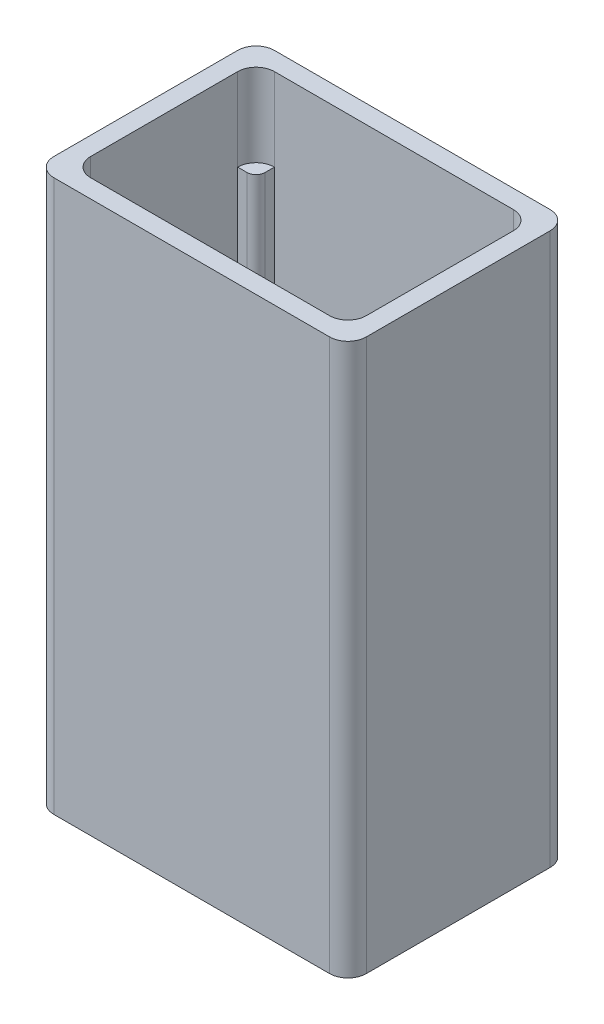
from build123d import *

# Parameters (mm, degrees)
BOSS_EXTRUDE4_DEPTH = 60
BOSS_EXTRUDE5_DEPTH = 51


with BuildPart() as part:
    # Sketch8 → Boss-Extrude4 (new body)
    with BuildSketch(Plane(origin=(0, 58, 0), x_dir=(1, 0, 0), z_dir=(0, 1, 0))):
        with BuildLine():
            Line((-15, -12), (15, -12))
            ThreePointArc((15, -12), (16.414213562, -11.414213562), (17, -10))
            Line((17, -10), (17, 10))
            ThreePointArc((17, 10), (16.414213562, 11.414213562), (15, 12))
            Line((15, 12), (-15, 12))
            ThreePointArc((-15, 12), (-16.414213562, 11.414213562), (-17, 10))
            Line((-17, 10), (-17, -10))
            ThreePointArc((-17, -10), (-16.414213562, -11.414213562), (-15, -12))
        make_face()
        with BuildLine():
            Line((-13, -10), (13, -10))
            ThreePointArc((13, -10), (14.414213562, -9.414213562), (15, -8))
            Line((15, -8), (15, 8))
            ThreePointArc((15, 8), (14.414213562, 9.414213562), (13, 10))
            Line((13, 10), (-13, 10))
            ThreePointArc((-13, 10), (-14.414213562, 9.414213562), (-15, 8))
            Line((-15, 8), (-15, -8))
            ThreePointArc((-15, -8), (-14.414213562, -9.414213562), (-13, -10))
        make_face(mode=Mode.SUBTRACT)
    extrude(amount=BOSS_EXTRUDE4_DEPTH)

    # Sketch11 → Boss-Extrude5 (add)
    with BuildSketch(Plane(origin=(0, 58, 0), x_dir=(1, 0, 0), z_dir=(0, 1, 0))):
        with BuildLine():
            Line((13, 10), (15, 10))
            Line((15, 10), (15, 6.937911183))
            Line((15, 6.937911183), (13.5, 6.937911183))
            ThreePointArc((13.5, 6.937911183), (13.146446609, 7.084357793), (13, 7.437911183))
            Line((13, 7.437911183), (13, 10))
        make_face()
        with BuildLine():
            Line((-13, 10), (-15, 10))
            Line((-15, 10), (-15, 8))
            Line((-15, 8), (-14, 8))
            ThreePointArc((-14, 8), (-13.292893219, 8.292893219), (-13, 9))
            Line((-13, 9), (-13, 10))
        make_face()
    extrude(amount=BOSS_EXTRUDE5_DEPTH)


solid = part.part
